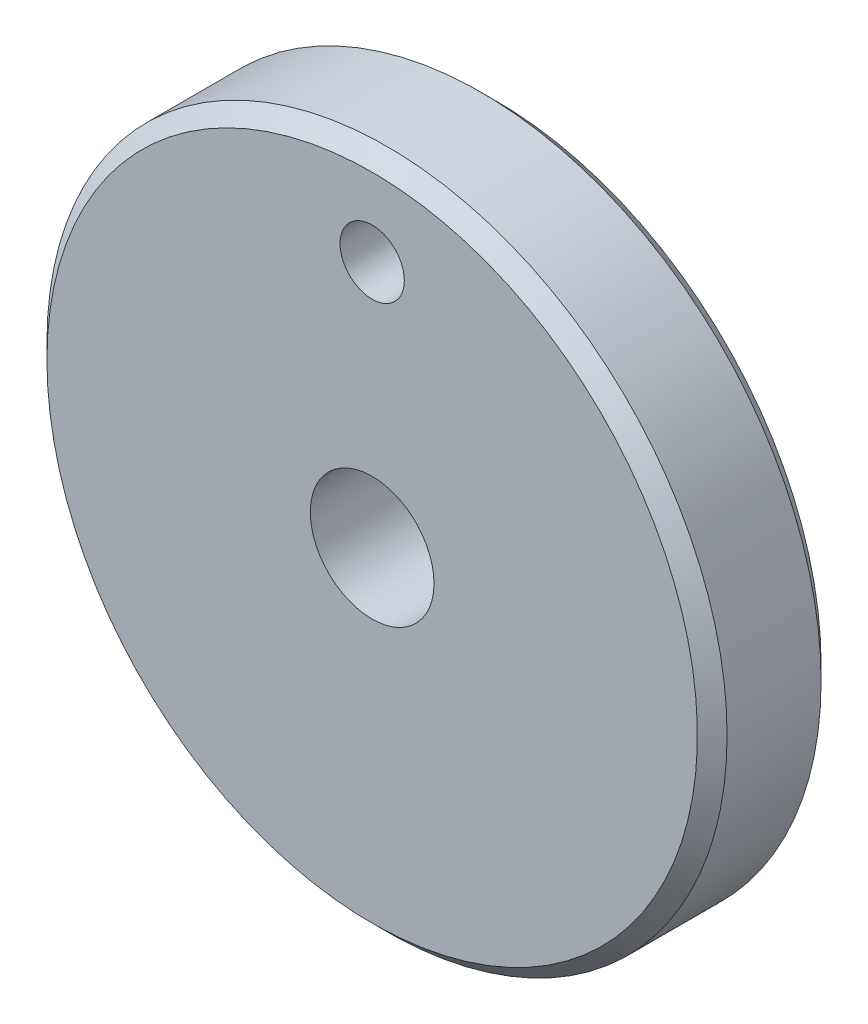
from build123d import *

# Parameters (mm, degrees)
SKETCH1_R           = 17.4625
SKETCH1_R_2         = 3.175
BOSS_EXTRUDE1_DEPTH = 6.35
SKETCH3_R           = 1.651
CUT_EXTRUDE3_DEPTH  = 16.51
CHAMFER1_SIZE       = 0.762
CHAMFER2_SIZE       = 0.762


with BuildPart() as part:
    # Sketch1 → Boss-Extrude1 (new body)
    with BuildSketch(Plane.XY):
        Circle(SKETCH1_R)
        Circle(SKETCH1_R_2, mode=Mode.SUBTRACT)
    extrude(amount=BOSS_EXTRUDE1_DEPTH)

    # Sketch3 → Cut-Extrude3 (cut)
    with BuildSketch(Plane.XY.offset(6.35)):
        with Locations((0, 12.7)):
            Circle(SKETCH3_R)
    extrude(amount=-CUT_EXTRUDE3_DEPTH, mode=Mode.SUBTRACT)

    # Chamfer1
    chamfer1_edges = [part.edges().sort_by_distance(p)[0] for p in [
        (-17.4625, 0, 6.35),
    ]]
    chamfer(chamfer1_edges, length=CHAMFER1_SIZE)

    # Chamfer2
    chamfer2_edges = [part.edges().sort_by_distance(p)[0] for p in [
        (-17.4625, 0, 0),
    ]]
    chamfer(chamfer2_edges, length=CHAMFER2_SIZE)


solid = part.part
